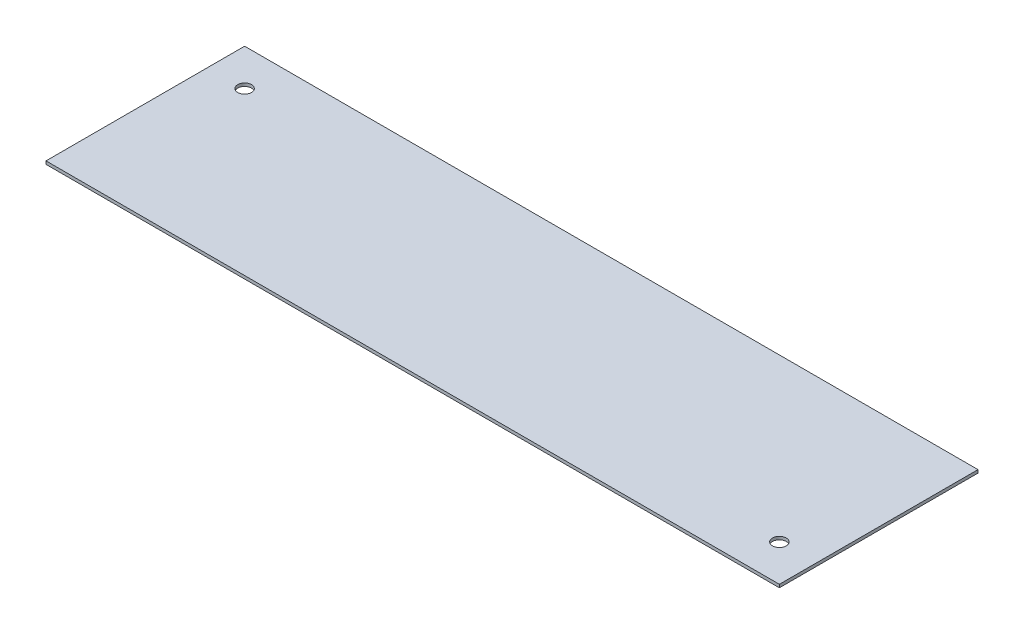
from build123d import *

# Parameters (mm, degrees)
SKETCH1_W            = 240
SKETCH1_H            = 65
BOSS_EXTRUDE1_DEPTH  = 1
M4_CLEARANCE_SLOT1_D = 4.5


with BuildPart() as part:
    # Sketch1 → Boss-Extrude1 (new body)
    with BuildSketch(Plane(origin=(0, 0, 0), x_dir=(1, 0, 0), z_dir=(0, 1, 0))):
        with Locations((-7.622516556, -0.291390728)):
            Rectangle(SKETCH1_W, SKETCH1_H)
    extrude(amount=BOSS_EXTRUDE1_DEPTH)

    # M4 Clearance Slot1 (through all)
    with Locations(Plane(origin=(0, 1, 0), x_dir=(1, 0, 0), z_dir=(0, 1, 0))):
        with Locations((100.377483444, -20.791390728), (-115.622516556, 20.208609272)):
            Hole(M4_CLEARANCE_SLOT1_D / 2)


solid = part.part
